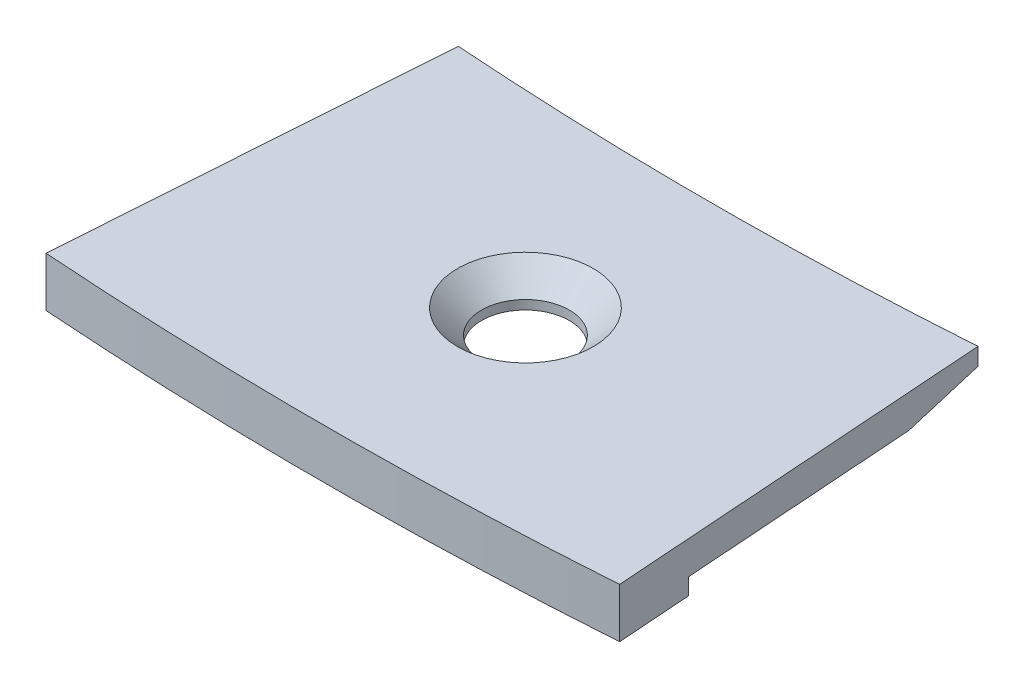
from build123d import *

# Parameters (mm, degrees)
SKETCH2_R           = 2.65
BOSS_EXTRUDE1_DEPTH = 2
BOSS_EXTRUDE2_DEPTH = 2
CHAMFER1_SIZE       = 4.5
CHAMFER1_SIZE2      = 0.956504528
BOSS_EXTRUDE3_START = 1
BOSS_EXTRUDE3_DEPTH = 1


with BuildPart() as part:
    # Sketch2 → Boss-Extrude1 (new body)
    with BuildSketch(Plane(origin=(0, 0, 0), x_dir=(1, 0, 0), z_dir=(0, 1, 0))):
        with BuildLine():
            Line((-15.984695958, -228.591802117), (-17.334483725, -247.89466649))
            ThreePointArc((-17.334483725, -247.89466649), (0, -248.5), (17.334483725, -247.89466649))
            Line((17.334483725, -247.89466649), (15.984695958, -228.591802117))
            ThreePointArc((15.984695958, -228.591802117), (0, -229.15), (-15.984695958, -228.591802117))
        make_face()
        with Locations(Location((0, -236.25, 0), (0, 0, 270))):
            Circle(SKETCH2_R, mode=Mode.SUBTRACT)
    extrude(amount=BOSS_EXTRUDE1_DEPTH)

    # Sketch3 → Boss-Extrude2 (add)
    with BuildSketch(Plane(origin=(0, 0, 0), x_dir=(1, 0, 0), z_dir=(0, 1, 0))):
        with BuildLine():
            Line((-15.705670063, -224.601545916), (-15.984695958, -228.591802117))
            ThreePointArc((-15.984695958, -228.591802117), (0, -229.15), (15.984695958, -228.591802117))
            Line((15.984695958, -228.591802117), (15.705670063, -224.601545916))
            ThreePointArc((15.705670063, -224.601545916), (0, -225.15), (-15.705670063, -224.601545916))
        make_face()
    extrude(amount=BOSS_EXTRUDE2_DEPTH)

    # Chamfer1
    chamfer1_edges = [part.edges().sort_by_distance(p)[0] for p in [
        (0, 0, 225.15),
    ]]
    chamfer1_side = [part.faces().sort_by_distance(p)[0] for p in [
        (16.100023839, 0, 236.277479174),
    ]]
    chamfer(chamfer1_edges, length=CHAMFER1_SIZE, length2=CHAMFER1_SIZE2, reference=chamfer1_side[0])

    # Sketch4 → Boss-Extrude3 (add)
    with BuildSketch(Plane.XZ.offset(BOSS_EXTRUDE3_START)):
        with BuildLine():
            Line((-17.334483725, 247.89466649), (-17.020579594, 243.405628263))
            ThreePointArc((-17.020579594, 243.405628263), (0, 244), (17.020579594, 243.405628263))
            Line((17.020579594, 243.405628263), (17.334483725, 247.89466649))
            ThreePointArc((17.334483725, 247.89466649), (0, 248.5), (-17.334483725, 247.89466649))
        make_face()
    extrude(amount=-BOSS_EXTRUDE3_DEPTH)

    # Sketch20 → CSK for M3.5 Flat Head Machine Screw2 (revolve, cut)
    with BuildSketch(Plane(origin=(0, 2, 236.25), x_dir=(0, 0, 1), z_dir=(1, 0, 0))):
        Polygon((0, 0), (0, 3), (1.85, 3), (1.85, 2.25), (4.1, 0), align=None)
    revolve(axis=Axis((0, 8.35, 236.25), (0, -1, 0)), mode=Mode.SUBTRACT)


solid = part.part
